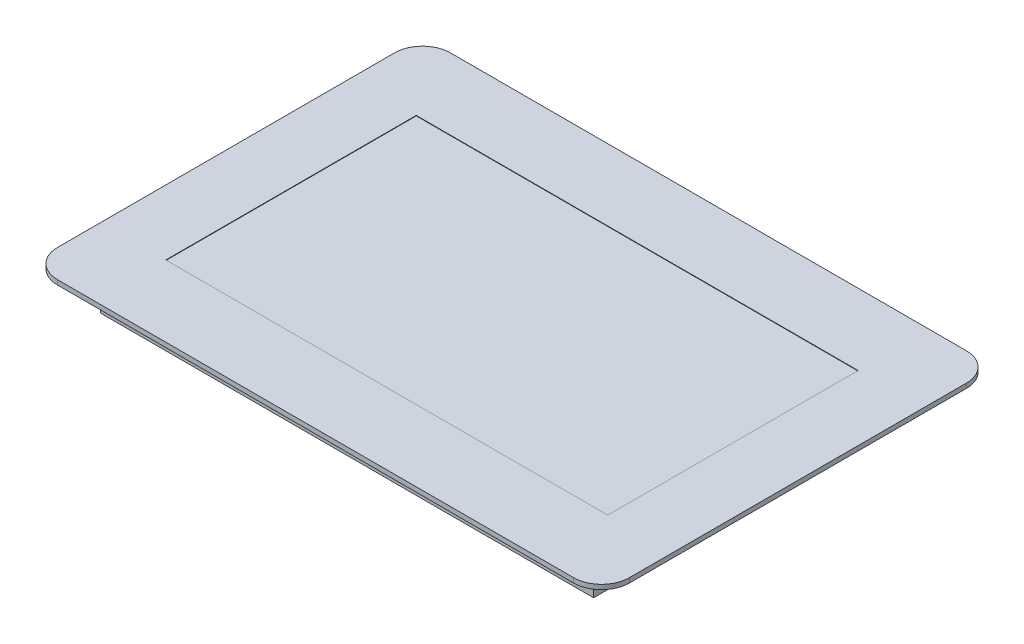
from build123d import *

# Parameters (mm, degrees)
SKETCH2_W           = 106
SKETCH2_H           = 67.7
BOSS_EXTRUDE1_DEPTH = 8.4
BOSS_EXTRUDE2_DEPTH = 1
SKETCH5_W           = 95.04
SKETCH5_H           = 53.86
CUT_EXTRUDE1_DEPTH  = 0.1


with BuildPart() as part:
    # Sketch2 → Boss-Extrude1 (new body)
    with BuildSketch(Plane(origin=(0, 0, 0), x_dir=(1, 0, 0), z_dir=(0, 1, 0))):
        Rectangle(SKETCH2_W, SKETCH2_H)
    extrude(amount=BOSS_EXTRUDE1_DEPTH)

    # Sketch3 → Boss-Extrude2 (add)
    with BuildSketch(Plane(origin=(0, 8.4, 0), x_dir=(1, 0, 0), z_dir=(0, 1, 0))):
        with BuildLine():
            Line((-55.5, 43.85), (55.5, 43.85))
            ThreePointArc((55.5, 43.85), (59.742640687, 42.092640687), (61.5, 37.85))
            Line((61.5, 37.85), (61.5, -34.65))
            ThreePointArc((61.5, -34.65), (59.742640687, -38.892640687), (55.5, -40.65))
            Line((55.5, -40.65), (-55.5, -40.65))
            ThreePointArc((-55.5, -40.65), (-59.742640687, -38.892640687), (-61.5, -34.65))
            Line((-61.5, -34.65), (-61.5, 37.85))
            ThreePointArc((-61.5, 37.85), (-59.742640687, 42.092640687), (-55.5, 43.85))
        make_face()
    extrude(amount=-BOSS_EXTRUDE2_DEPTH)

    # Sketch5 → Cut-Extrude1 (cut)
    with BuildSketch(Plane(origin=(0, 8.4, 0), x_dir=(1, 0, 0), z_dir=(0, 1, 0))):
        with Locations((0, 1.6)):
            Rectangle(SKETCH5_W, SKETCH5_H)
    extrude(amount=-CUT_EXTRUDE1_DEPTH, mode=Mode.SUBTRACT)


solid = part.part
